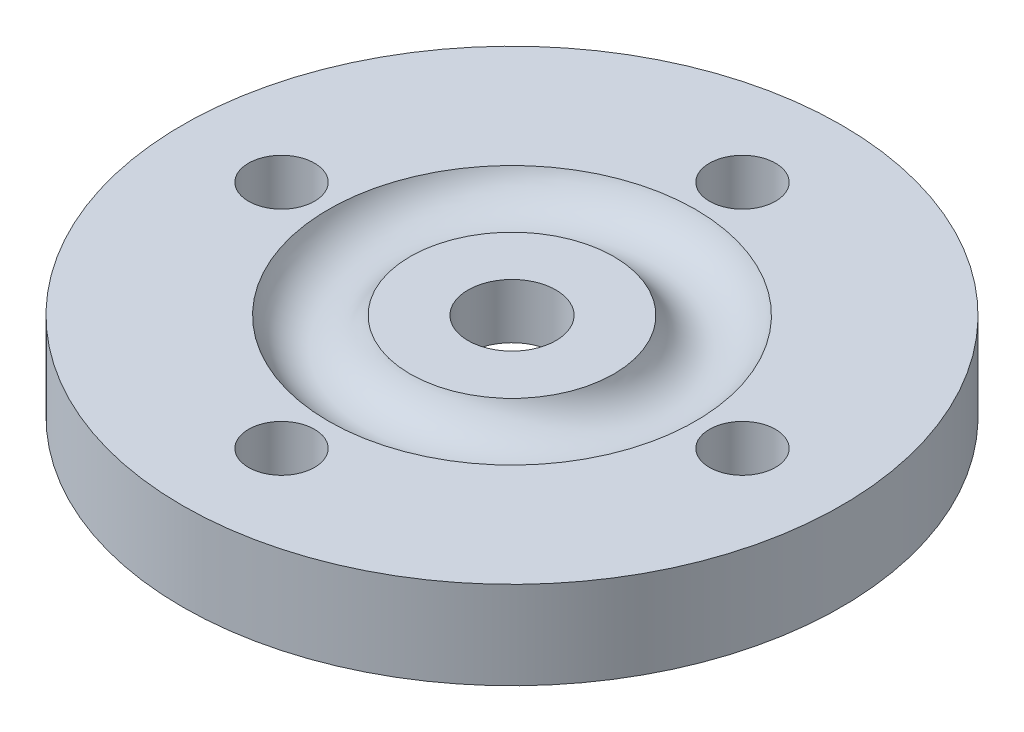
from build123d import *

# Parameters (mm, degrees)
SKETCH1_R          = 11.9126
SKETCH1_R_2        = 1.1938
EXTRUDE1_DEPTH     = 3.175
SKETCH3_R          = 1.5875
CUT_EXTRUDE1_START = -1.9812
SKETCH1_3_R        = 3.5687
SKETCH1_3_R_2      = 1.5875
CUT_EXTRUDE1_DEPTH = 3.175
SKETCH1_4_R        = 1.5875
CUT_EXTRUDE2_DEPTH = 3.175


with BuildPart() as part:
    # Sketch1 → Extrude1 (new body)
    with BuildSketch(Plane(origin=(0, 0, 0), x_dir=(1, 0, 0), z_dir=(0, 1, 0))):
        with Locations(Location((0, 0, 0), (0, 0, 270))):
            Circle(SKETCH1_R)
        with Locations(Location((0, 8.3312, 0), (0, 0, 270))):
            Circle(SKETCH1_R_2, mode=Mode.SUBTRACT)
        with Locations(Location((8.3312, 0, 0), (0, 0, 270))):
            Circle(SKETCH1_R_2, mode=Mode.SUBTRACT)
        with Locations(Location((0, -8.3312, 0), (0, 0, 270))):
            Circle(SKETCH1_R_2, mode=Mode.SUBTRACT)
        with Locations(Location((-8.3312, 0, 0), (0, 0, 270))):
            Circle(SKETCH1_R_2, mode=Mode.SUBTRACT)
    extrude(amount=-EXTRUDE1_DEPTH)

    # Sketch3 → Cut-Revolve1 (revolve, cut)
    with BuildSketch(Plane.XY, mode=Mode.PRIVATE) as cut_revolve1_sk:
        with Locations((5.1562, 0.5842)):
            Circle(SKETCH3_R)
    revolve(cut_revolve1_sk.sketch.rotate(Axis((0, 5.548517396, 0), (0, -1, 0)), 90), axis=Axis((0, 5.548517396, 0), (0, -1, 0)), mode=Mode.SUBTRACT)

    # Sketch1<3> → Cut-Extrude1 (cut)
    # profile 1 of 2: a face of its own
    with BuildSketch(Plane(origin=(0, 0, 0), x_dir=(1, 0, 0), z_dir=(0, 1, 0)).offset(CUT_EXTRUDE1_START)):
        with Locations(Location((0, 0, 0), (0, 0, 270))):
            Circle(SKETCH1_3_R)
        Circle(SKETCH1_3_R_2, mode=Mode.SUBTRACT)
    # profile 2 of 2: a face of its own
    with BuildSketch(Plane(origin=(0, 0, 0), x_dir=(1, 0, 0), z_dir=(0, 1, 0)).offset(CUT_EXTRUDE1_START)):
        Circle(SKETCH1_3_R_2)
    extrude(amount=-CUT_EXTRUDE1_DEPTH, mode=Mode.SUBTRACT)

    # Sketch1<4> → Cut-Extrude2 (cut)
    with BuildSketch(Plane(origin=(0, 0, 0), x_dir=(1, 0, 0), z_dir=(0, 1, 0))):
        with Locations(Location((0, 0, 0), (0, 0, 270))):
            Circle(SKETCH1_4_R)
    extrude(amount=-CUT_EXTRUDE2_DEPTH, mode=Mode.SUBTRACT)


solid = part.part
